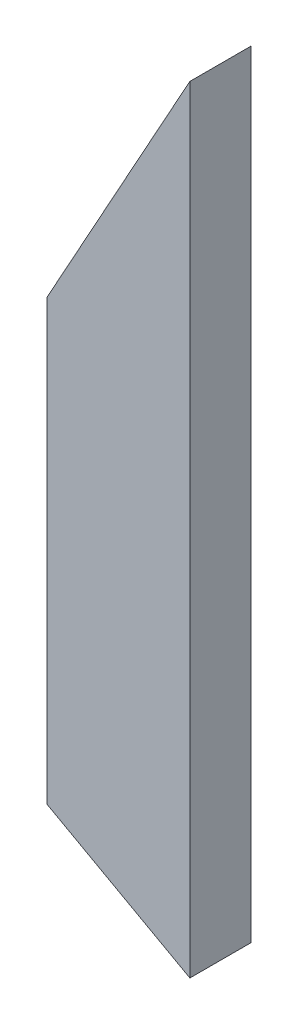
from build123d import *

# Parameters (mm, degrees)
BOSS_EXTRUDE1_DEPTH = 38.1


with BuildPart() as part:
    # Sketch1 → Boss-Extrude1 (new body)
    with BuildSketch(Plane.XY):
        Polygon((44.45, -241.3), (44.45, 241.3), (-44.45, 80.537750917), (-44.45, -192.113111503), align=None)
    extrude(amount=BOSS_EXTRUDE1_DEPTH)


solid = part.part
